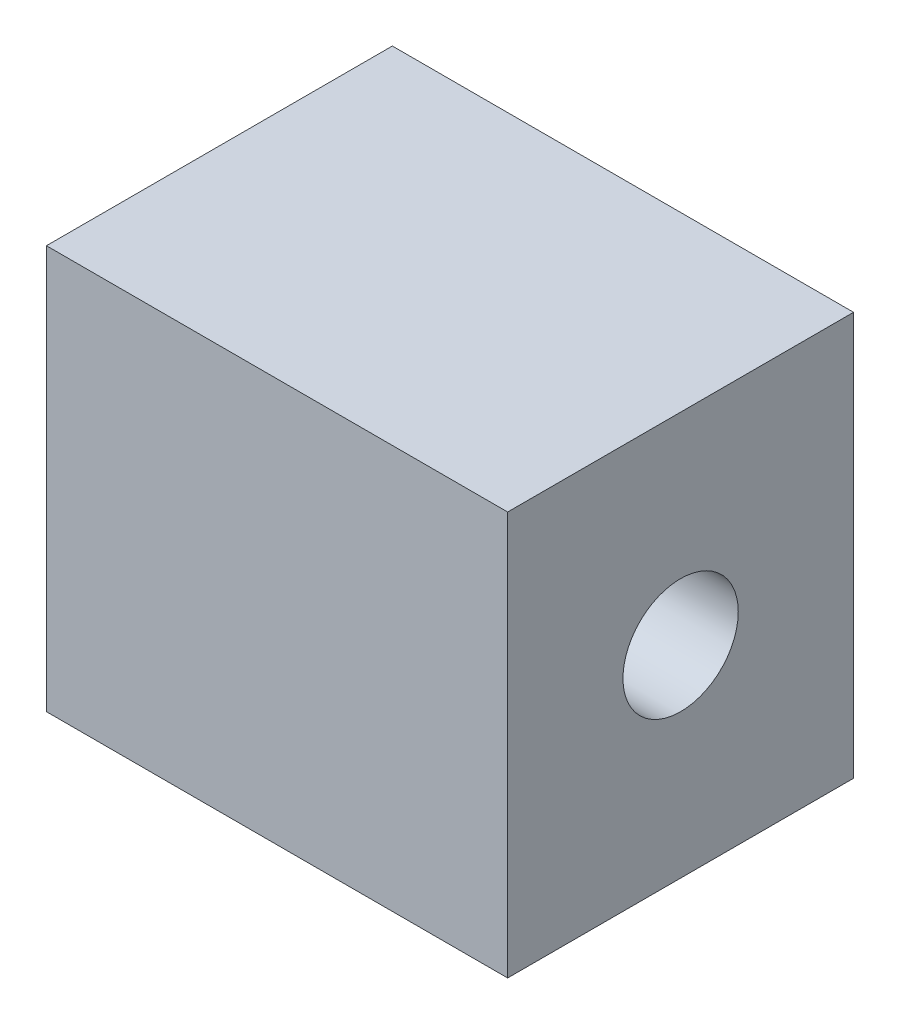
from build123d import *

# Parameters (mm, degrees)
SKETCH_1_W          = 40
SKETCH_1_H          = 35
EXTRUDE_1_DEPTH     = 30
SKETCH_2_R          = 2.5
CUT_EXTRUDE_2_DEPTH = 20
SKETCH_3_R          = 5
CUT_EXTRUDE_3_DEPTH = 53.974050251


with BuildPart() as part:
    # 草图1 → 凸台-拉伸1 (new body)
    with BuildSketch(Plane.XY):
        Rectangle(SKETCH_1_W, SKETCH_1_H)
    extrude(amount=EXTRUDE_1_DEPTH)

    # 草图2 → 切除-拉伸2 (cut)
    with BuildSketch(Plane.XY):
        with Locations((-14, 10.5)):
            Circle(SKETCH_2_R)
        with Locations((14, 10.5)):
            Circle(SKETCH_2_R)
        with Locations((14, -10.5)):
            Circle(SKETCH_2_R)
        with Locations((-14, -10.5)):
            Circle(SKETCH_2_R)
    extrude(amount=CUT_EXTRUDE_2_DEPTH, mode=Mode.SUBTRACT)

    # 草图3 → 切除-拉伸3 (cut, through all)
    with BuildSketch(Plane(origin=(20, 0, 0), x_dir=(0, 0, -1), z_dir=(1, 0, 0))):
        with Locations((-15, 0)):
            Circle(SKETCH_3_R)
    extrude(amount=-CUT_EXTRUDE_3_DEPTH, mode=Mode.SUBTRACT)


solid = part.part
